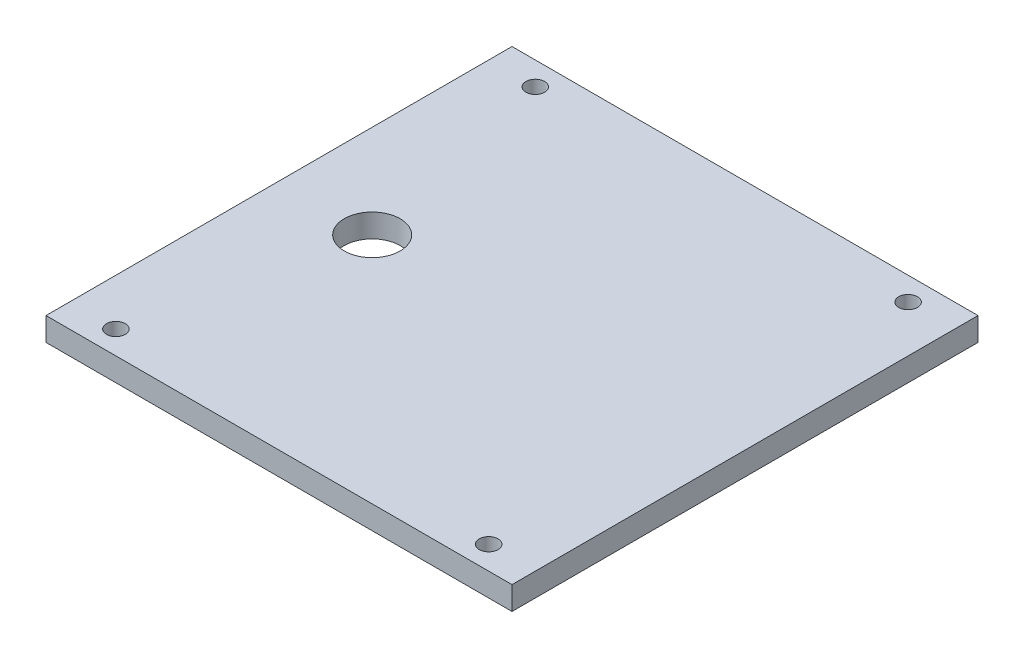
from build123d import *

# Parameters (mm, degrees)
SKETCH2_W           = 127
SKETCH2_H           = 127
BOSS_EXTRUDE1_DEPTH = 6.35
SKETCH6_R           = 2.5527
CUT_EXTRUDE3_DEPTH  = 9.525
CUT_EXTRUDE4_REACH  = 93.356
SKETCH7_R           = 7.62


with BuildPart() as part:
    # Sketch2 → Boss-Extrude1 (new body)
    with BuildSketch(Plane(origin=(0, 0, 0), x_dir=(1, 0, 0), z_dir=(0, 1, 0))):
        with Locations((-1.871480339, 0)):
            Rectangle(SKETCH2_W, SKETCH2_H)
    extrude(amount=BOSS_EXTRUDE1_DEPTH)

    # Sketch6 → Cut-Extrude3 (cut)
    with BuildSketch(Plane(origin=(0, 6.35, 0), x_dir=(1, 0, 0), z_dir=(0, 1, 0))):
        with Locations(Location((-52.671480339, 57.15, 0), (0, 0, 270))):
            Circle(SKETCH6_R)
        with Locations(Location((-52.671480339, -57.15, 0), (0, 0, 270))):
            Circle(SKETCH6_R)
        with Locations(Location((48.928519661, -57.15, 0), (0, 0, 270))):
            Circle(SKETCH6_R)
        with Locations(Location((48.928519661, 57.15, 0), (0, 0, 270))):
            Circle(SKETCH6_R)
    extrude(amount=-CUT_EXTRUDE3_DEPTH, mode=Mode.SUBTRACT)

    # Sketch7 → Cut-Extrude4 (cut, up to next)
    with BuildSketch(Plane(origin=(0, 6.35, 0), x_dir=(1, 0, 0), z_dir=(0, 1, 0)), mode=Mode.PRIVATE) as cut_extrude4_sk1:
        with Locations(Location((-39.971480339, 0, 0), (0, 0, 270))):
            Circle(SKETCH7_R)
    cut_extrude4_tool1 = extrude(cut_extrude4_sk1.sketch, amount=-CUT_EXTRUDE4_REACH, mode=Mode.PRIVATE) & part.part
    add(cut_extrude4_tool1.solids().sort_by_distance((-39.97148, 6.35, 0))[0], mode=Mode.SUBTRACT)


solid = part.part
